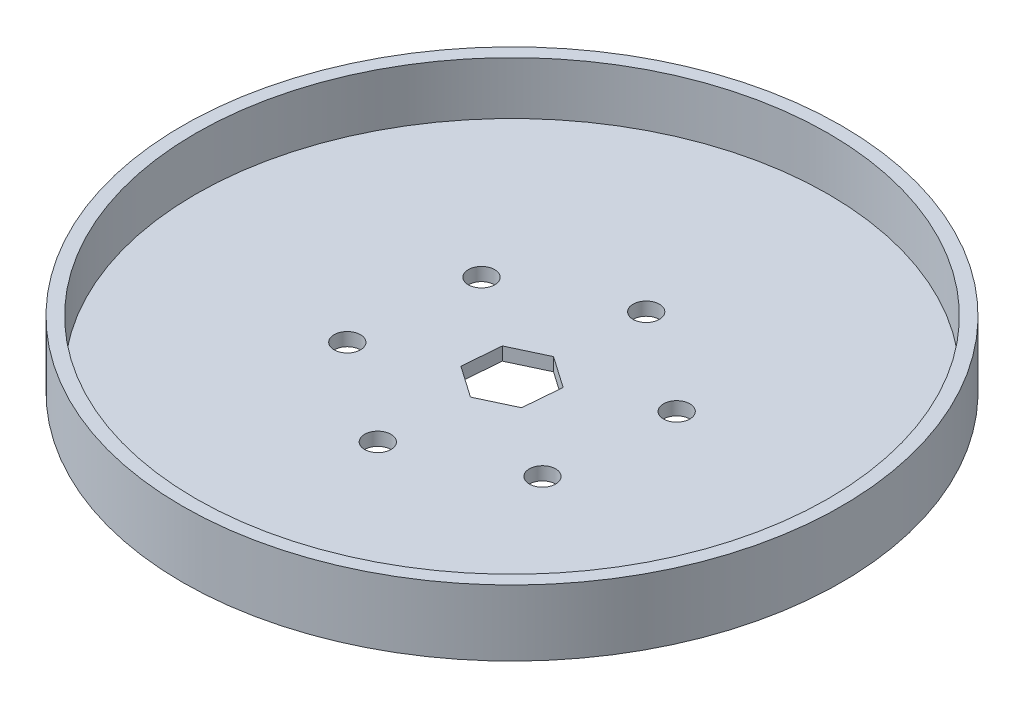
from build123d import *

# Parameters (mm, degrees)
SKETCH1_R           = 63.5
BOSS_EXTRUDE1_DEPTH = 12.7
SKETCH7_R           = 2.54
CUT_EXTRUDE2_DEPTH  = 91.696141042
CUT_EXTRUDE3_DEPTH  = 91.696141042
SHELL1_T            = -2.54


with BuildPart() as part:
    # Sketch1 → Boss-Extrude1 (new body)
    with BuildSketch(Plane(origin=(0, 0, 0), x_dir=(1, 0, 0), z_dir=(0, 1, 0))):
        with Locations(Location((0, 0, 0), (0, 0, 270))):
            Circle(SKETCH1_R)
    extrude(amount=-BOSS_EXTRUDE1_DEPTH)

    # Sketch7 → Cut-Extrude2 (cut, through all)
    with BuildSketch(Plane(origin=(0, 0, 0), x_dir=(1, 0, 0), z_dir=(0, 1, 0))):
        with Locations(Location((19.563011922, -13.687656502, 0), (0, 0, 270))):
            Circle(SKETCH7_R)
        with Locations(Location((21.635364211, 10.098237048, 0), (0, 0, 270))):
            Circle(SKETCH7_R)
        with Locations(Location((2.072352288, 23.78589355, 0), (0, 0, 270))):
            Circle(SKETCH7_R)
        with Locations(Location((-19.563011922, 13.687656502, 0), (0, 0, 270))):
            Circle(SKETCH7_R)
        with Locations(Location((-21.635364211, -10.098237048, 0), (0, 0, 270))):
            Circle(SKETCH7_R)
        with Locations(Location((-2.072352288, -23.78589355, 0), (0, 0, 270))):
            Circle(SKETCH7_R)
    extrude(amount=-CUT_EXTRUDE2_DEPTH, mode=Mode.SUBTRACT)

    # Sketch8 → Cut-Extrude3 (cut, through all)
    with BuildSketch(Plane(origin=(0, 0, 0), x_dir=(1, 0, 0), z_dir=(0, 1, 0))):
        Polygon((-6.702144956, -3.150433197), (-0.622717296, -7.37944439), (6.079427659, -4.229011193), (6.702144956, 3.150433197), (0.622717296, 7.37944439), (-6.079427659, 4.229011193), align=None)
    extrude(amount=-CUT_EXTRUDE3_DEPTH, mode=Mode.SUBTRACT)

    # Shell1
    shell1_openings = [part.faces().sort_by_distance(p)[0] for p in [
        (-2.072352288, -6.35, 21.24589355),
        (19.563011922, -6.35, 11.147656502),
        (0, 0, -61.703948776),
        (-21.635364211, -6.35, 7.558237048),
        (-19.563011922, -6.35, -16.227656502),
        (2.072352288, -6.35, -26.32589355),
        (21.635364211, -6.35, -12.638237048),
        (-6.390786307, -6.35, -0.539288998),
        (-2.728355181, -6.35, -5.804227791),
        (3.662431126, -6.35, -5.264938793),
        (6.390786307, -6.35, 0.539288998),
        (2.728355181, -6.35, 5.804227791),
        (-3.662431126, -6.35, 5.264938793),
    ]]
    offset(amount=SHELL1_T, openings=shell1_openings, kind=Kind.INTERSECTION)


solid = part.part
